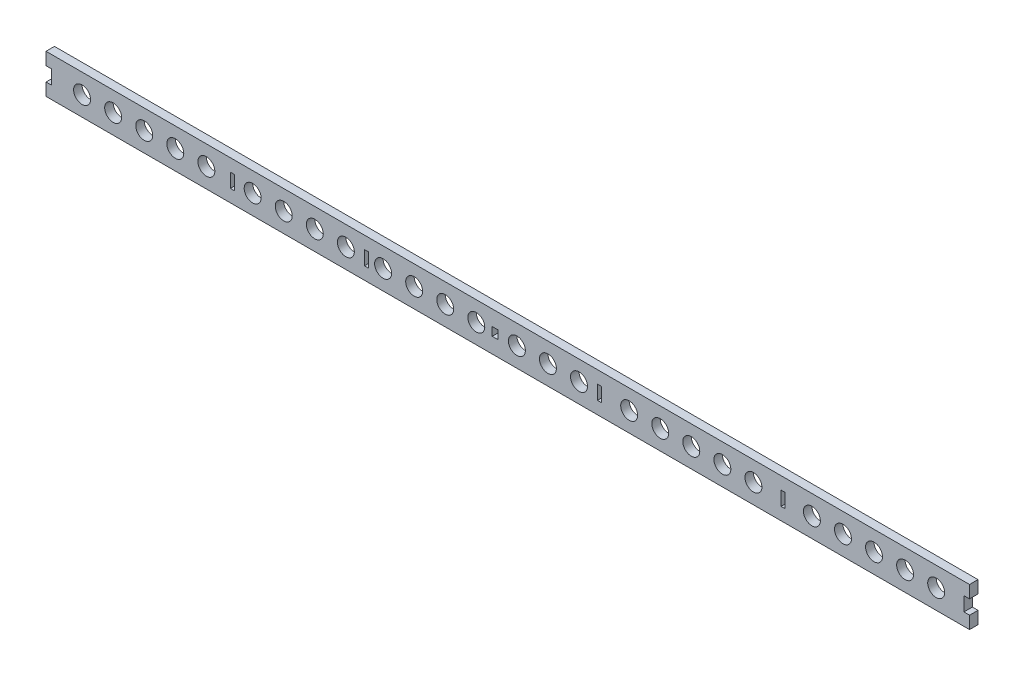
from build123d import *

# Parameters (mm, degrees)
MODEL_R         = 3
MODEL_W         = 1.5
MODEL_H         = 5
MODEL_W_2       = 2
MODEL_H_2       = 3
EXTRUDE_1_DEPTH = 3


with BuildPart() as part:
    # Model → 凸台-拉伸1 (new body)
    with BuildSketch(Plane.XY):
        Polygon((13.851287916, 22.788853141), (13.851287916, 18.367254581), (15.851287916, 18.367254581), (15.851287916, 13.367254581), (13.851287916, 13.367254581), (13.851287916, 8.945653722), (29.822931445, 8.945653722), (340.851287916, 8.945653722), (340.851287916, 13.367254581), (338.851287916, 13.367254581), (338.851287916, 18.367254581), (340.851287916, 18.367254581), (340.851287916, 22.788853141), (29.824992994, 22.788853141), align=None)
        with Locations((26.631213357, 15.867254581)):
            Circle(MODEL_R, mode=Mode.SUBTRACT)
        with Locations((37.631213357, 15.867254581)):
            Circle(MODEL_R, mode=Mode.SUBTRACT)
        with Locations((48.631213357, 15.867254581)):
            Circle(MODEL_R, mode=Mode.SUBTRACT)
        with Locations((59.631213357, 15.867254581)):
            Circle(MODEL_R, mode=Mode.SUBTRACT)
        with Locations((70.631213357, 15.867254581)):
            Circle(MODEL_R, mode=Mode.SUBTRACT)
        with Locations((87.026286184, 15.867254581)):
            Circle(MODEL_R, mode=Mode.SUBTRACT)
        with Locations((98.026286184, 15.867254581)):
            Circle(MODEL_R, mode=Mode.SUBTRACT)
        with Locations((109.026286184, 15.867254581)):
            Circle(MODEL_R, mode=Mode.SUBTRACT)
        with Locations((120.026286184, 15.867254581)):
            Circle(MODEL_R, mode=Mode.SUBTRACT)
        with Locations((133.205424602, 15.867254581)):
            Circle(MODEL_R, mode=Mode.SUBTRACT)
        with Locations((144.205424602, 15.867254581)):
            Circle(MODEL_R, mode=Mode.SUBTRACT)
        with Locations((155.205424602, 15.867254581)):
            Circle(MODEL_R, mode=Mode.SUBTRACT)
        with Locations((166.205424602, 15.867254581)):
            Circle(MODEL_R, mode=Mode.SUBTRACT)
        with Locations((180.575631043, 15.867254581)):
            Circle(MODEL_R, mode=Mode.SUBTRACT)
        with Locations((191.575631043, 15.867254581)):
            Circle(MODEL_R, mode=Mode.SUBTRACT)
        with Locations((202.575631043, 15.867254581)):
            Circle(MODEL_R, mode=Mode.SUBTRACT)
        with Locations((220.335604036, 15.867254581)):
            Circle(MODEL_R, mode=Mode.SUBTRACT)
        with Locations((231.335604036, 15.867254581)):
            Circle(MODEL_R, mode=Mode.SUBTRACT)
        with Locations((242.335604036, 15.867254581)):
            Circle(MODEL_R, mode=Mode.SUBTRACT)
        with Locations((253.335604036, 15.867254581)):
            Circle(MODEL_R, mode=Mode.SUBTRACT)
        with Locations((264.335604036, 15.867254581)):
            Circle(MODEL_R, mode=Mode.SUBTRACT)
        with Locations((285.040254887, 15.867254581)):
            Circle(MODEL_R, mode=Mode.SUBTRACT)
        with Locations((296.040254887, 15.867254581)):
            Circle(MODEL_R, mode=Mode.SUBTRACT)
        with Locations((307.040254887, 15.867254581)):
            Circle(MODEL_R, mode=Mode.SUBTRACT)
        with Locations((318.040254887, 15.867254581)):
            Circle(MODEL_R, mode=Mode.SUBTRACT)
        with Locations((329.040254887, 15.867254581)):
            Circle(MODEL_R, mode=Mode.SUBTRACT)
        with Locations((79.851287916, 15.867254581)):
            Rectangle(MODEL_W, MODEL_H, mode=Mode.SUBTRACT)
        with Locations((209.851287916, 15.867254581)):
            Rectangle(MODEL_W, MODEL_H, mode=Mode.SUBTRACT)
        with Locations((274.851287916, 15.867254581)):
            Rectangle(MODEL_W, MODEL_H, mode=Mode.SUBTRACT)
        with Locations((172.851287916, 15.87827705)):
            Rectangle(MODEL_W_2, MODEL_H_2, mode=Mode.SUBTRACT)
        with Locations((127.351287916, 15.867254581)):
            Rectangle(MODEL_W, MODEL_H, mode=Mode.SUBTRACT)
    extrude(amount=EXTRUDE_1_DEPTH)


solid = part.part
